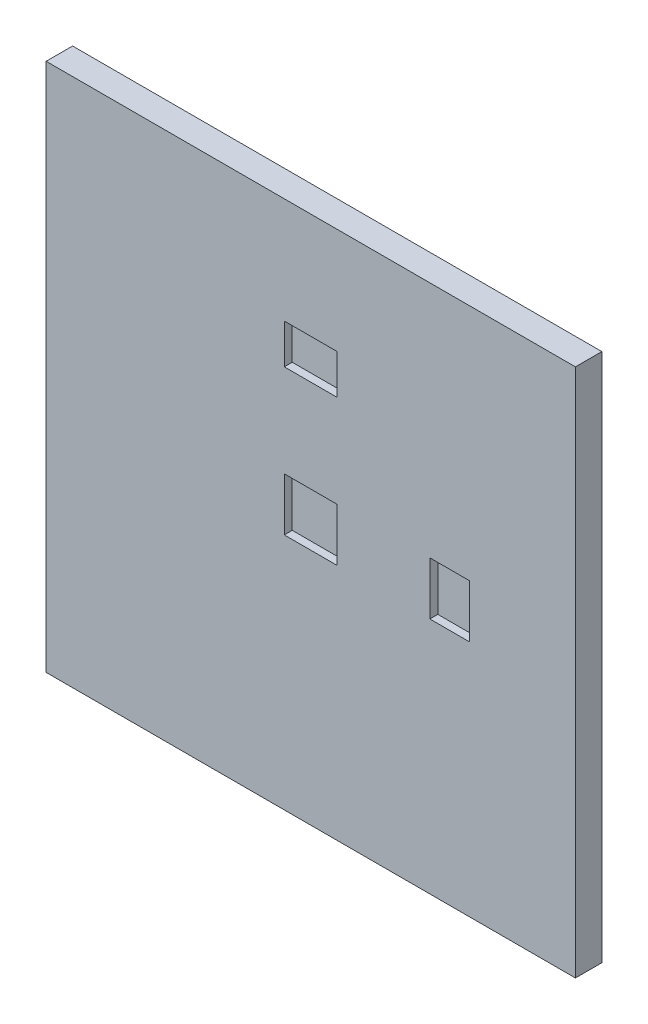
from build123d import *

# Parameters (mm, degrees)
SKETCH1_W           = 200
SKETCH1_H           = 200
BOSS_EXTRUDE1_DEPTH = 10
SKETCH2_W           = 20
SKETCH2_H           = 20
CUT_EXTRUDE2_DEPTH  = 3
SKETCH3_W           = 20
SKETCH3_H           = 15
SKETCH3_W_2         = 15
SKETCH3_H_2         = 20
CUT_EXTRUDE3_DEPTH  = 3


with BuildPart() as part:
    # Sketch1 → Boss-Extrude1 (new body)
    with BuildSketch(Plane.XY):
        with Locations((-100, -100)):
            Rectangle(SKETCH1_W, SKETCH1_H)
    extrude(amount=BOSS_EXTRUDE1_DEPTH)

    # Sketch2 → Cut-Extrude2 (cut)
    with BuildSketch(Plane.XY.offset(10)):
        with Locations((-100, -100)):
            Rectangle(SKETCH2_W, SKETCH2_H)
    extrude(amount=-CUT_EXTRUDE2_DEPTH, mode=Mode.SUBTRACT)

    # Sketch3 → Cut-Extrude3 (cut)
    with BuildSketch(Plane.XY.offset(10)):
        with Locations((-100, -47.5)):
            Rectangle(SKETCH3_W, SKETCH3_H)
        with Locations((-47.5, -100)):
            Rectangle(SKETCH3_W_2, SKETCH3_H_2)
    extrude(amount=-CUT_EXTRUDE3_DEPTH, mode=Mode.SUBTRACT)


solid = part.part
